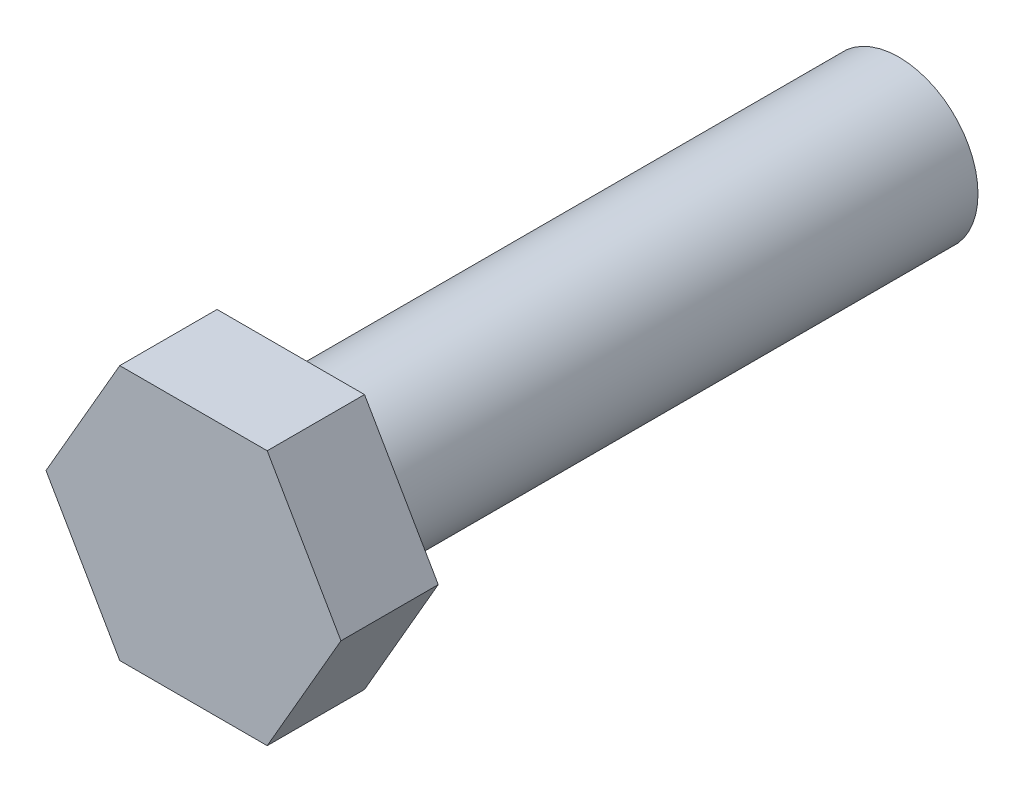
from build123d import *

# Parameters (mm, degrees)
BOSS_EXTRUDE1_DEPTH = 20.32
SKETCH2_R           = 16.51
BOSS_EXTRUDE2_DEPTH = 127


with BuildPart() as part:
    # Sketch1 → Boss-Extrude1 (new body)
    with BuildSketch(Plane.XY):
        Polygon((30.795863359, 0), (15.397931679, 26.67), (-15.397931679, 26.67), (-30.795863359, 0), (-15.397931679, -26.67), (15.397931679, -26.67), align=None)
    extrude(amount=BOSS_EXTRUDE1_DEPTH)

    # Sketch2 → Boss-Extrude2 (add)
    with BuildSketch(Plane(origin=(0, 0, 0), x_dir=(-1, 0, 0), z_dir=(0, 0, -1))):
        with Locations(Location((0, 0, 0), (0, 0, 180))):
            Circle(SKETCH2_R)
    extrude(amount=BOSS_EXTRUDE2_DEPTH)


solid = part.part
